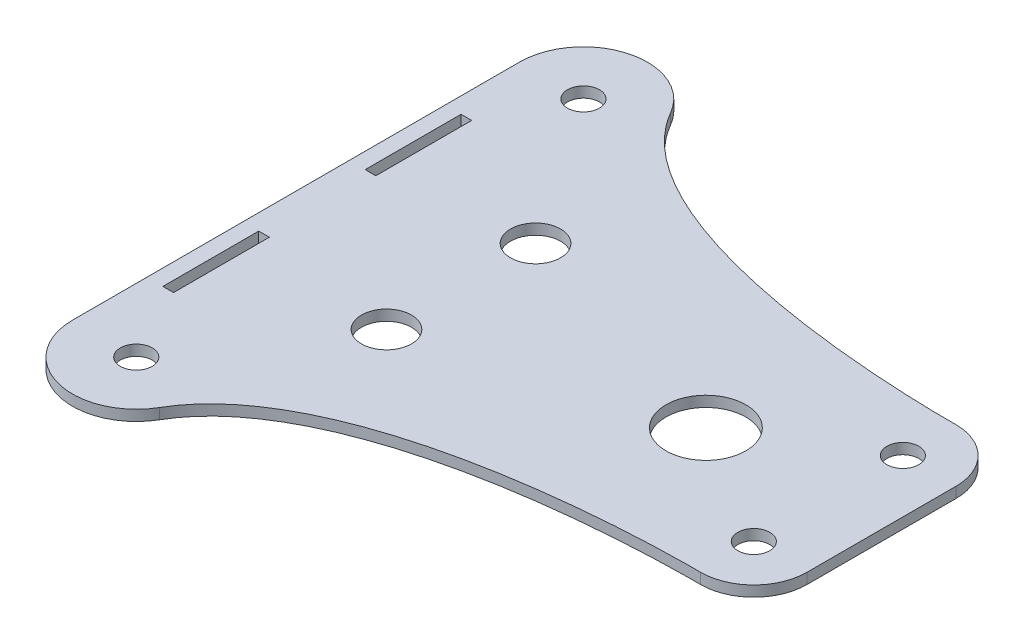
from build123d import *

# Parameters (mm, degrees)
ESQUISSE1_R             = 37.5
ESQUISSE1_R_2           = 15
ESQUISSE1_R_3           = 23.5
BOSS_EXTRU_2_DEPTH      = 10
ESQUISSE2_W             = 10
ESQUISSE2_H             = 90
ENL_V_MAT_EXTRU_1_DEPTH = 10


with BuildPart() as part:
    # Esquisse1 → Boss.-Extru.2 (new body)
    with BuildSketch(Plane(origin=(0, 0, 0), x_dir=(1, 0, 0), z_dir=(0, 1, 0))):
        with BuildLine():
            Line((20, 480), (20, 60))
            ThreePointArc((20, 60), (64.470857294, 2.044450423), (131.961524227, 30))
            add(Edge.make_bspline(
                [(131.961524227, 30), (204.728797974, 156.036615257), (519.671151051, 149.91974963), (520, 150)],
                knots=[0, 0, 0, 0, 1, 1, 1, 1], degree=3))
            ThreePointArc((520, 150), (555.355339059, 164.644660941), (570, 200))
            Line((570, 200), (570, 340))
            ThreePointArc((570, 340), (555.355339059, 375.355339059), (520, 390))
            add(Edge.make_bspline(
                [(131.961524227, 510), (204.728797974, 383.963384743), (519.671151051, 390.08025037), (520, 390)],
                knots=[0, 0, 0, 0, 1, 1, 1, 1], degree=3))
            ThreePointArc((131.961524227, 510), (64.470857294, 537.955549577), (20, 480))
        make_face()
        with Locations(Location((405, 270, 0), (0, 0, 270))):
            Circle(ESQUISSE1_R, mode=Mode.SUBTRACT)
        with Locations(Location((520, 200, 0), (0, 0, 270))):
            Circle(ESQUISSE1_R_2, mode=Mode.SUBTRACT)
        with Locations(Location((520, 340, 0), (0, 0, 270))):
            Circle(ESQUISSE1_R_2, mode=Mode.SUBTRACT)
        with Locations(Location((80, 480, 0), (0, 0, 270))):
            Circle(ESQUISSE1_R_2, mode=Mode.SUBTRACT)
        with Locations(Location((80, 60, 0), (0, 0, 270))):
            Circle(ESQUISSE1_R_2, mode=Mode.SUBTRACT)
        with Locations(Location((175, 340, 0), (0, 0, 270))):
            Circle(ESQUISSE1_R_3, mode=Mode.SUBTRACT)
        with Locations(Location((175, 200, 0), (0, 0, 270))):
            Circle(ESQUISSE1_R_3, mode=Mode.SUBTRACT)
    extrude(amount=BOSS_EXTRU_2_DEPTH)

    # Esquisse2 → Enlèv. mat.-Extru.1 (cut)
    with BuildSketch(Plane(origin=(0, 10, 0), x_dir=(1, 0, 0), z_dir=(0, 1, 0))):
        with Locations((40, 175)):
            Rectangle(ESQUISSE2_W, ESQUISSE2_H)
        with Locations((40, 365)):
            Rectangle(ESQUISSE2_W, ESQUISSE2_H)
    extrude(amount=-ENL_V_MAT_EXTRU_1_DEPTH, mode=Mode.SUBTRACT)


solid = part.part
